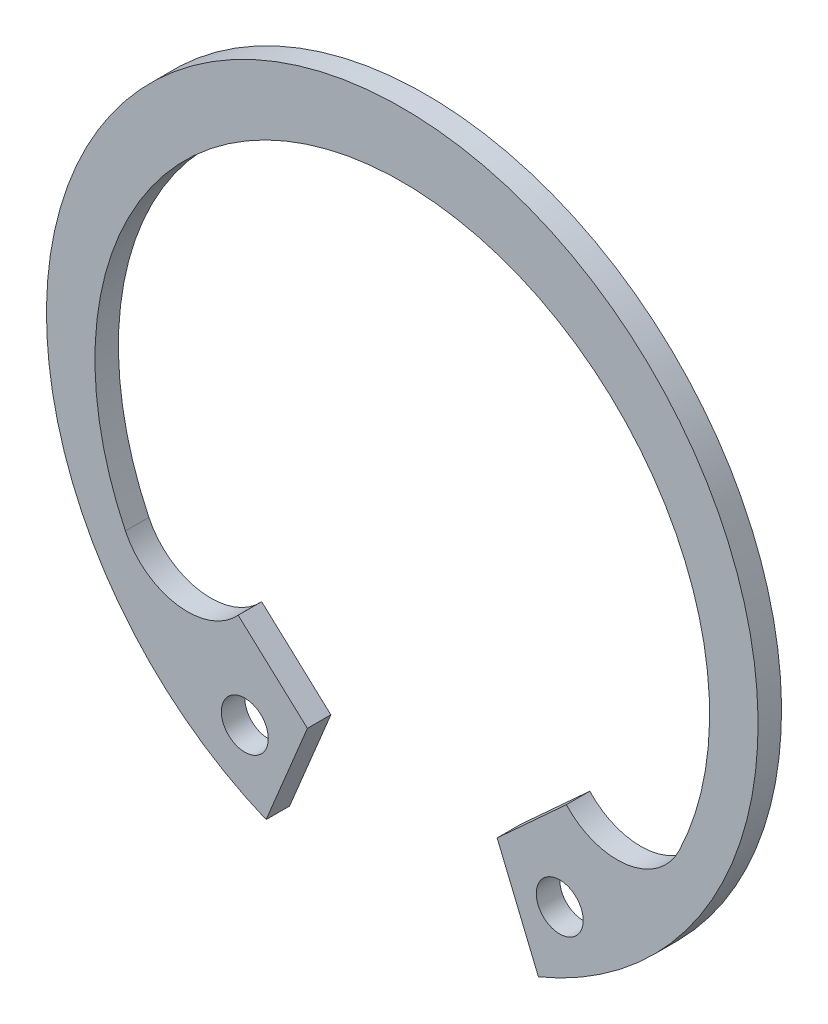
from build123d import *

# Parameters (mm, degrees)
EXTRUDE_1003_DEPTH      = 0.75
EXTRUDE_1003_DEPTH_BACK = 0.75
SKETCH_1_R              = 1.5


with BuildPart() as part:
    # 草图1 → Extrude 1003 (new, two sides: drawn at the far end of the back side and taken through both)
    with BuildSketch(Plane.XY.offset(-EXTRUDE_1003_DEPTH_BACK)):
        with BuildLine():
            Line((-10.491561876, -10.592532295), (-6.065532403, -14.64349059))
            Line((-6.065532403, -14.64349059), (-8.706048086, -21.018259365))
            ThreePointArc((-8.706048086, -21.018259365), (0, 22.75), (8.706048086, -21.018259365))
            Line((8.706048086, -21.018259365), (6.065532403, -14.64349059))
            Line((6.065532403, -14.64349059), (10.491561876, -10.592532295))
            ThreePointArc((10.491561876, -10.592532295), (14.377460618, -11.975014118), (17.700870528, -9.532390201))
            ThreePointArc((17.700870528, -9.532390201), (0, 18.65), (-17.700870528, -9.532390201))
            ThreePointArc((-17.700870528, -9.532390201), (-14.377460618, -11.975014118), (-10.491561876, -10.592532295))
        make_face()
        with Locations((-10.067656556, -16.46609521)):
            Circle(SKETCH_1_R, mode=Mode.SUBTRACT)
        with Locations((10.067656556, -16.46609521)):
            Circle(SKETCH_1_R, mode=Mode.SUBTRACT)
    extrude(amount=EXTRUDE_1003_DEPTH + EXTRUDE_1003_DEPTH_BACK)


solid = part.part
